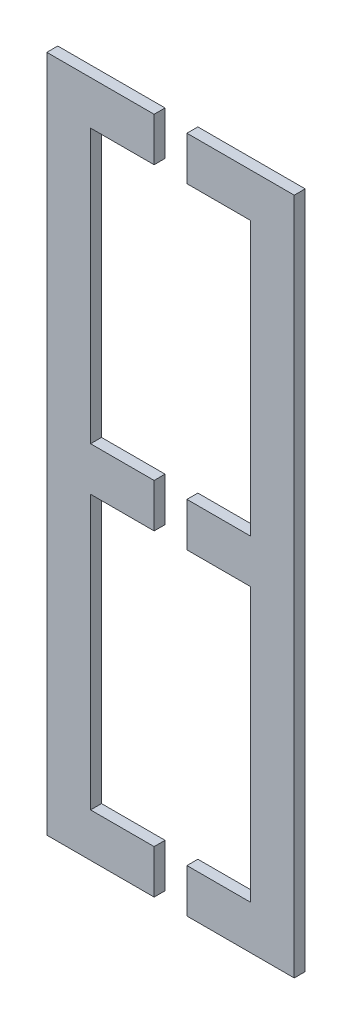
from build123d import *

# Parameters (mm, degrees)
SALIENTE_EXTRUIR1_DEPTH   = 6.35
SALIENTE_EXTRUIR1_2_DEPTH = 6.35


with BuildPart() as part:
    # Croquis1 → Saliente-Extruir1 (new body)
    with BuildSketch(Plane.XY):
        Polygon((0, 0), (62.300000114, 0), (62.300000114, 25.4), (25.4, 25.4), (25.4, 184.12500005), (62.300000114, 184.12500005), (62.300000114, 209.52500005), (25.4, 209.52500005), (25.4, 368.2500001), (62.300000114, 368.2500001), (62.300000114, 393.6500001), (0, 393.6500001), align=None)
    extrude(amount=SALIENTE_EXTRUIR1_DEPTH)


with BuildPart() as body_2:
    # Croquis1 → Saliente-Extruir1 2 (new body)
    with BuildSketch(Plane.XY):
        Polygon((81.350000114, 184.12500005), (81.350000114, 209.52500005), (118.250000228, 209.52500005), (118.250000228, 368.2500001), (81.350000114, 368.2500001), (81.350000114, 393.6500001), (143.650000228, 393.6500001), (143.650000228, 0), (81.350000114, 0), (81.350000114, 25.4), (118.250000228, 25.4), (118.250000228, 184.12500005), align=None)
    extrude(amount=SALIENTE_EXTRUIR1_2_DEPTH)


solid = Compound([part.part, body_2.part])
